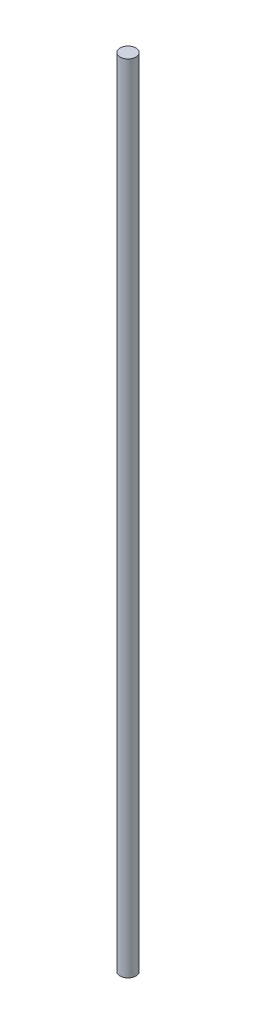
from build123d import *

# Parameters (mm, degrees)
ESQUISSE1_R        = 1
BOSS_EXTRU_1_DEPTH = 100


with BuildPart() as part:
    # Esquisse1 → Boss.-Extru.1 (new body)
    with BuildSketch(Plane(origin=(0, 0, 0), x_dir=(1, 0, 0), z_dir=(0, 1, 0))):
        with Locations(Location((-18.938989748, 21.606453093, 0), (0, 0, 270))):
            Circle(ESQUISSE1_R)
    extrude(amount=BOSS_EXTRU_1_DEPTH)


solid = part.part
